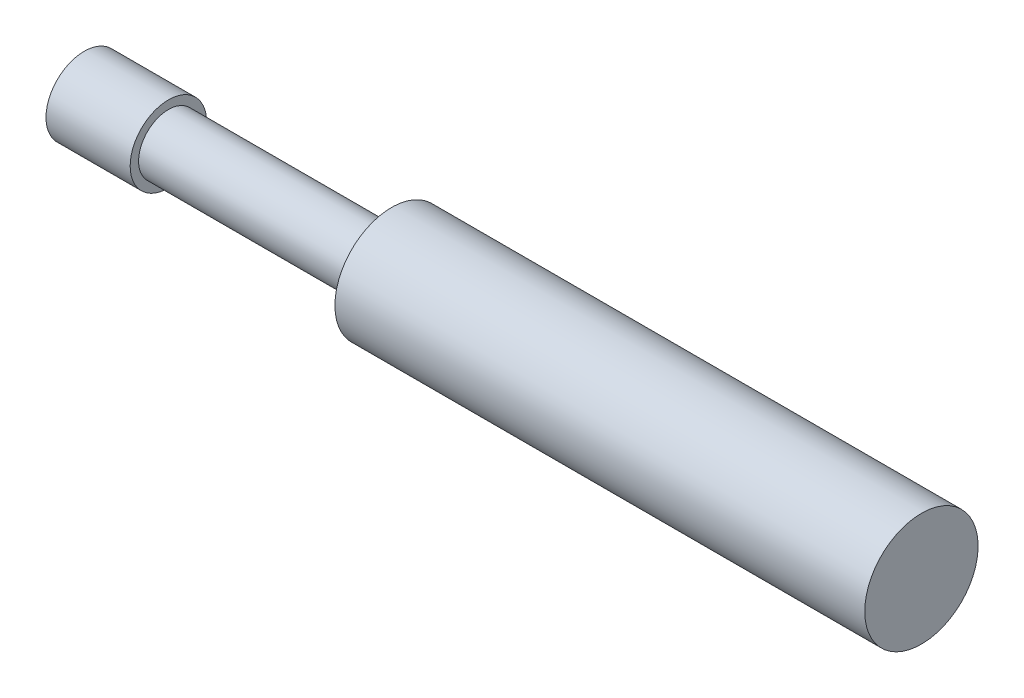
from build123d import *


with BuildPart() as part:
    # Sketch2 → Revolve1 (revolve)
    with BuildSketch(Plane.XY, mode=Mode.PRIVATE) as revolve1_sk:
        Polygon((0, 0), (-112.268, 0), (-112.268, 13.97), (-81.52370007, 13.97), (-81.52370007, 10.895570007), (0, 10.895570007), (0, 20.701), (193.548, 20.701), (193.548, 0), align=None)
    revolve(revolve1_sk.sketch.rotate(Axis((0, 0, 0), (1, 0, 0)), 90), axis=Axis((0, 0, 0), (1, 0, 0)))


solid = part.part
